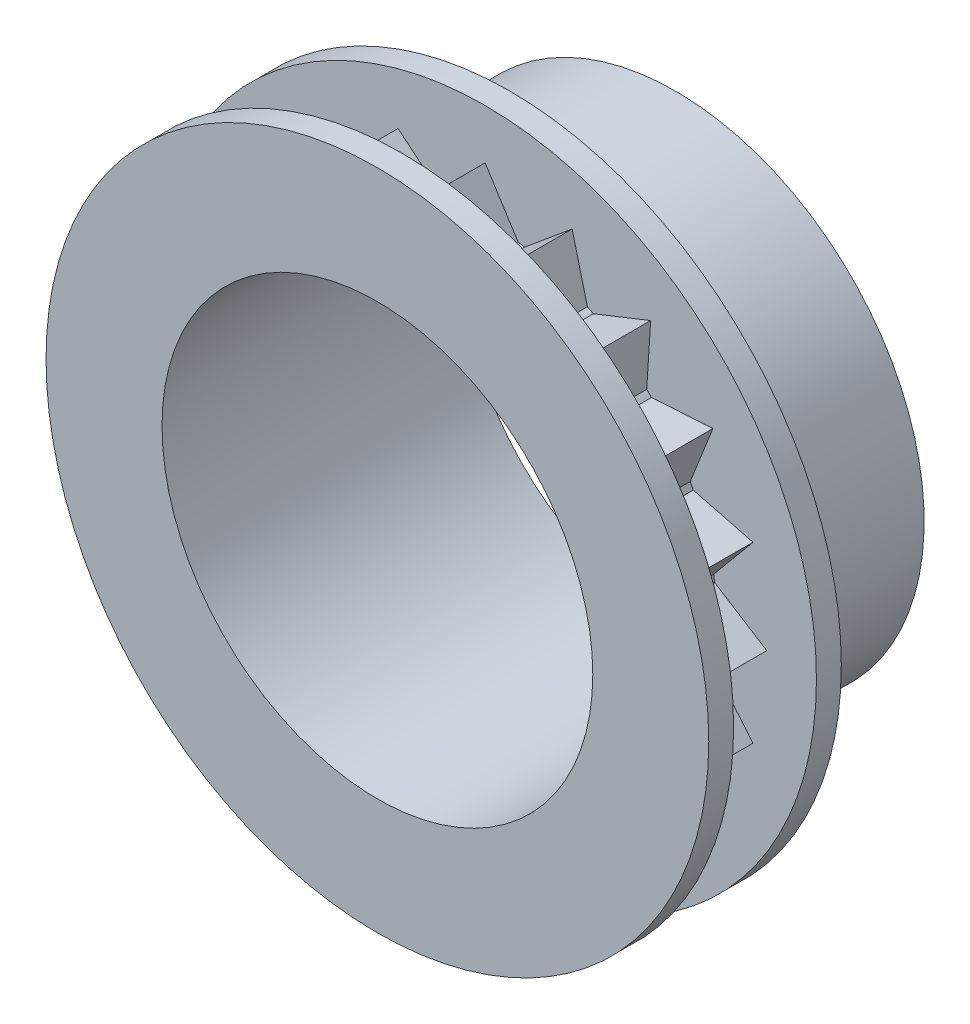
from build123d import *

# Parameters (mm, degrees)
BOSS_EXTRUDE1_DEPTH = 5
SKETCH2_R           = 20
BOSS_EXTRUDE2_DEPTH = 1.5
BOSS_EXTRUDE3_START = 1.5
SKETCH3_R           = 20
BOSS_EXTRUDE3_DEPTH = 1.5
SKETCH4_R           = 13
CUT_EXTRUDE1_DEPTH  = 11.5
SKETCH5_R           = 15
BOSS_EXTRUDE4_DEPTH = 10
CUT_EXTRUDE2_START  = -30
SKETCH6_R           = 13
CUT_EXTRUDE2_DEPTH  = 30


with BuildPart() as part:
    # Sketch1 → Boss-Extrude1 (new body)
    with BuildSketch(Plane.XY):
        with BuildLine():
            Line((0, 17), (-1.990617103, 13.857757522))
            ThreePointArc((-1.990617103, 13.857757522), (-2.190082511, 13.827636768), (-2.389093211, 13.794645107))
            Line((-2.389093211, 13.794645107), (-5.253288904, 16.167960777))
            Line((-5.253288904, 16.167960777), (-6.175471945, 12.564376079))
            ThreePointArc((-6.175471945, 12.564376079), (-6.355866996, 12.474091339), (-6.534942436, 12.381216715))
            Line((-6.534942436, 12.381216715), (-9.992349289, 13.753288904))
            Line((-9.992349289, 13.753288904), (-9.755828567, 10.041105964))
            ThreePointArc((-9.755828567, 10.041105964), (-9.899494937, 9.899494937), (-10.041105964, 9.755828567))
            Line((-10.041105964, 9.755828567), (-13.753288904, 9.992349289))
            Line((-13.753288904, 9.992349289), (-12.381216715, 6.534942436))
            ThreePointArc((-12.381216715, 6.534942436), (-12.474091339, 6.355866996), (-12.564376079, 6.175471945))
            Line((-12.564376079, 6.175471945), (-16.167960777, 5.253288904))
            Line((-16.167960777, 5.253288904), (-13.794645107, 2.389093211))
            ThreePointArc((-13.794645107, 2.389093211), (-13.827636768, 2.190082511), (-13.857757522, 1.990617103))
            Line((-13.857757522, 1.990617103), (-17, 0))
            Line((-17, 0), (-13.857757522, -1.990617103))
            ThreePointArc((-13.857757522, -1.990617103), (-13.827636768, -2.190082511), (-13.794645107, -2.389093211))
            Line((-13.794645107, -2.389093211), (-16.167960777, -5.253288904))
            Line((-16.167960777, -5.253288904), (-12.564376079, -6.175471945))
            ThreePointArc((-12.564376079, -6.175471945), (-12.474091339, -6.355866996), (-12.381216715, -6.534942436))
            Line((-12.381216715, -6.534942436), (-13.753288904, -9.992349289))
            Line((-13.753288904, -9.992349289), (-10.041105964, -9.755828567))
            ThreePointArc((-10.041105964, -9.755828567), (-9.899494937, -9.899494937), (-9.755828567, -10.041105964))
            Line((-9.755828567, -10.041105964), (-9.992349289, -13.753288904))
            Line((-9.992349289, -13.753288904), (-6.534942436, -12.381216715))
            ThreePointArc((-6.534942436, -12.381216715), (-6.355866996, -12.474091339), (-6.175471945, -12.564376079))
            Line((-6.175471945, -12.564376079), (-5.253288904, -16.167960777))
            Line((-5.253288904, -16.167960777), (-2.389093211, -13.794645107))
            ThreePointArc((-2.389093211, -13.794645107), (-2.190082511, -13.827636768), (-1.990617103, -13.857757522))
            Line((-1.990617103, -13.857757522), (0, -17))
            Line((0, -17), (1.990617103, -13.857757522))
            ThreePointArc((1.990617103, -13.857757522), (2.190082511, -13.827636768), (2.389093211, -13.794645107))
            Line((2.389093211, -13.794645107), (5.253288904, -16.167960777))
            Line((5.253288904, -16.167960777), (6.175471945, -12.564376079))
            ThreePointArc((6.175471945, -12.564376079), (6.355866996, -12.474091339), (6.534942436, -12.381216715))
            Line((6.534942436, -12.381216715), (9.992349289, -13.753288904))
            Line((9.992349289, -13.753288904), (9.755828567, -10.041105964))
            ThreePointArc((9.755828567, -10.041105964), (9.899494937, -9.899494937), (10.041105964, -9.755828567))
            Line((10.041105964, -9.755828567), (13.753288904, -9.992349289))
            Line((13.753288904, -9.992349289), (12.381216715, -6.534942436))
            ThreePointArc((12.381216715, -6.534942436), (12.474091339, -6.355866996), (12.564376079, -6.175471945))
            Line((12.564376079, -6.175471945), (16.167960777, -5.253288904))
            Line((16.167960777, -5.253288904), (13.794645107, -2.389093211))
            ThreePointArc((13.794645107, -2.389093211), (13.827636768, -2.190082511), (13.857757522, -1.990617103))
            Line((13.857757522, -1.990617103), (17, 0))
            Line((17, 0), (13.857757522, 1.990617103))
            ThreePointArc((13.857757522, 1.990617103), (13.827636768, 2.190082511), (13.794645107, 2.389093211))
            Line((13.794645107, 2.389093211), (16.167960777, 5.253288904))
            Line((16.167960777, 5.253288904), (12.564376079, 6.175471945))
            ThreePointArc((12.564376079, 6.175471945), (12.474091339, 6.355866996), (12.381216715, 6.534942436))
            Line((12.381216715, 6.534942436), (13.753288904, 9.992349289))
            Line((13.753288904, 9.992349289), (10.041105964, 9.755828567))
            ThreePointArc((10.041105964, 9.755828567), (9.899494937, 9.899494937), (9.755828567, 10.041105964))
            Line((9.755828567, 10.041105964), (9.992349289, 13.753288904))
            Line((9.992349289, 13.753288904), (6.534942436, 12.381216715))
            ThreePointArc((6.534942436, 12.381216715), (6.355866996, 12.474091339), (6.175471945, 12.564376079))
            Line((6.175471945, 12.564376079), (5.253288904, 16.167960777))
            Line((5.253288904, 16.167960777), (2.389093211, 13.794645107))
            ThreePointArc((2.389093211, 13.794645107), (2.190082511, 13.827636768), (1.990617103, 13.857757522))
            Line((1.990617103, 13.857757522), (0, 17))
        make_face()
    extrude(amount=BOSS_EXTRUDE1_DEPTH)

    # Sketch2 → Boss-Extrude2 (add)
    with BuildSketch(Plane(origin=(0, 0, 0), x_dir=(-1, 0, 0), z_dir=(0, 0, -1))):
        Circle(SKETCH2_R)
    extrude(amount=BOSS_EXTRUDE2_DEPTH)

    # Sketch3 → Boss-Extrude3 (add)
    with BuildSketch(Plane.XY.offset(5).offset(BOSS_EXTRUDE3_START)):
        with Locations(Location((0, 0, 0), (0, 0, 180))):
            Circle(SKETCH3_R)
    extrude(amount=-BOSS_EXTRUDE3_DEPTH)

    # Sketch4 → Cut-Extrude1 (cut)
    with BuildSketch(Plane.XY.offset(6.5)):
        Circle(SKETCH4_R)
    extrude(amount=-CUT_EXTRUDE1_DEPTH, mode=Mode.SUBTRACT)

    # Sketch5 → Boss-Extrude4 (add)
    with BuildSketch(Plane(origin=(0, 0, -1.5), x_dir=(-1, 0, 0), z_dir=(0, 0, -1))):
        Circle(SKETCH5_R)
    extrude(amount=BOSS_EXTRUDE4_DEPTH)

    # Sketch6 → Cut-Extrude2 (cut)
    with BuildSketch(Plane(origin=(0, 0, -11.5), x_dir=(-1, 0, 0), z_dir=(0, 0, -1)).offset(CUT_EXTRUDE2_START)):
        with Locations(Location((0, 0, 0), (0, 0, 180))):
            Circle(SKETCH6_R)
    extrude(amount=CUT_EXTRUDE2_DEPTH, mode=Mode.SUBTRACT)


solid = part.part
